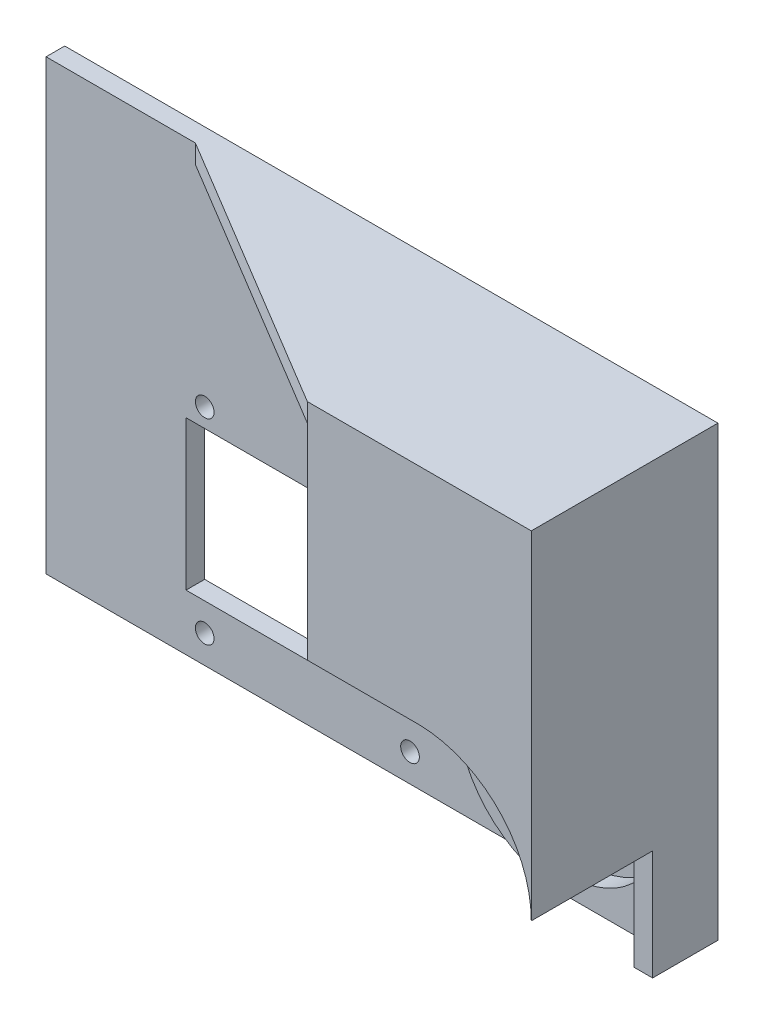
from build123d import *

# Parameters (mm, degrees)
SKETCH1_W           = 58
SKETCH1_H           = 48
BOSS_EXTRUDE1_DEPTH = 2
SKETCH2_R           = 1
SKETCH2_W           = 27
SKETCH2_H           = 16
CUT_EXTRUDE1_DEPTH  = 2
SKETCH3_W           = 54
SKETCH3_H           = 2
BOSS_EXTRUDE2_DEPTH = 18
CUT_EXTRUDE2_DEPTH  = 2
BOSS_EXTRUDE3_DEPTH = 46
BOSS_EXTRUDE4_DEPTH = 2
CUT_EXTRUDE3_DEPTH  = 13
SKETCH8_W           = 2
SKETCH8_H           = 48
BOSS_EXTRUDE5_DEPTH = 12


with BuildPart() as part:
    # Sketch1 → Boss-Extrude1 (new body)
    with BuildSketch(Plane.XY):
        with Locations((29, -24)):
            Rectangle(SKETCH1_W, SKETCH1_H)
    extrude(amount=BOSS_EXTRUDE1_DEPTH)

    # Sketch2 → Cut-Extrude1 (cut)
    with BuildSketch(Plane.XY.offset(2)):
        with Locations((5, -45)):
            Circle(SKETCH2_R)
        with Locations((27, -45)):
            Circle(SKETCH2_R)
        with Locations((5, -24)):
            Circle(SKETCH2_R)
        with Locations((27, -24)):
            Circle(SKETCH2_R)
        with Locations((16.5, -34)):
            Rectangle(SKETCH2_W, SKETCH2_H)
    extrude(amount=-CUT_EXTRUDE1_DEPTH, mode=Mode.SUBTRACT)

    # Sketch3 → Boss-Extrude2 (add)
    with BuildSketch(Plane.XY.offset(2)):
        with Locations((31, -1)):
            Rectangle(SKETCH3_W, SKETCH3_H)
    extrude(amount=BOSS_EXTRUDE2_DEPTH)

    # Sketch4 → Cut-Extrude2 (cut)
    with BuildSketch(Plane(origin=(0, 0, 0), x_dir=(1, 0, 0), z_dir=(0, 1, 0))):
        Polygon((4, -2), (34, -20), (4, -20), align=None)
    extrude(amount=-CUT_EXTRUDE2_DEPTH, mode=Mode.SUBTRACT)

    # Sketch5 → Boss-Extrude3 (add)
    with BuildSketch(Plane.XZ.offset(2)):
        Polygon((58, 20), (34, 20), (34, 18), (56, 18), (56, 2), (58, 2), (58, 18), align=None)
    extrude(amount=BOSS_EXTRUDE3_DEPTH)

    # Sketch6 → Boss-Extrude4 (add)
    with BuildSketch(Plane.XY.offset(2)):
        with BuildLine():
            Line((36, -36.2), (34, -36.2))
            ThreePointArc((34, -36.2), (37.527046669, -44.614867795), (46, -48))
            Line((46, -48), (57, -48))
            Line((57, -48), (57, -36.2))
            Line((57, -36.2), (56, -36.2))
            ThreePointArc((56, -36.2), (46, -46), (36, -36.2))
        make_face()
    extrude(amount=BOSS_EXTRUDE4_DEPTH)

    # Sketch7 → Cut-Extrude3 (cut)
    with BuildSketch(Plane.XY.offset(20)):
        with BuildLine():
            Line((58, -48), (58, -36.2))
            ThreePointArc((58, -36.2), (54.497222311, -27.64371576), (46, -24))
            Line((46, -24), (34, -24))
            Line((34, -24), (34, -48))
            Line((34, -48), (58, -48))
        make_face()
    extrude(amount=-CUT_EXTRUDE3_DEPTH, mode=Mode.SUBTRACT)

    # Sketch8 → Boss-Extrude5 (add)
    with BuildSketch(Plane.ZY):
        with Locations((1, -24)):
            Rectangle(SKETCH8_W, SKETCH8_H)
    extrude(amount=BOSS_EXTRUDE5_DEPTH)


solid = part.part
